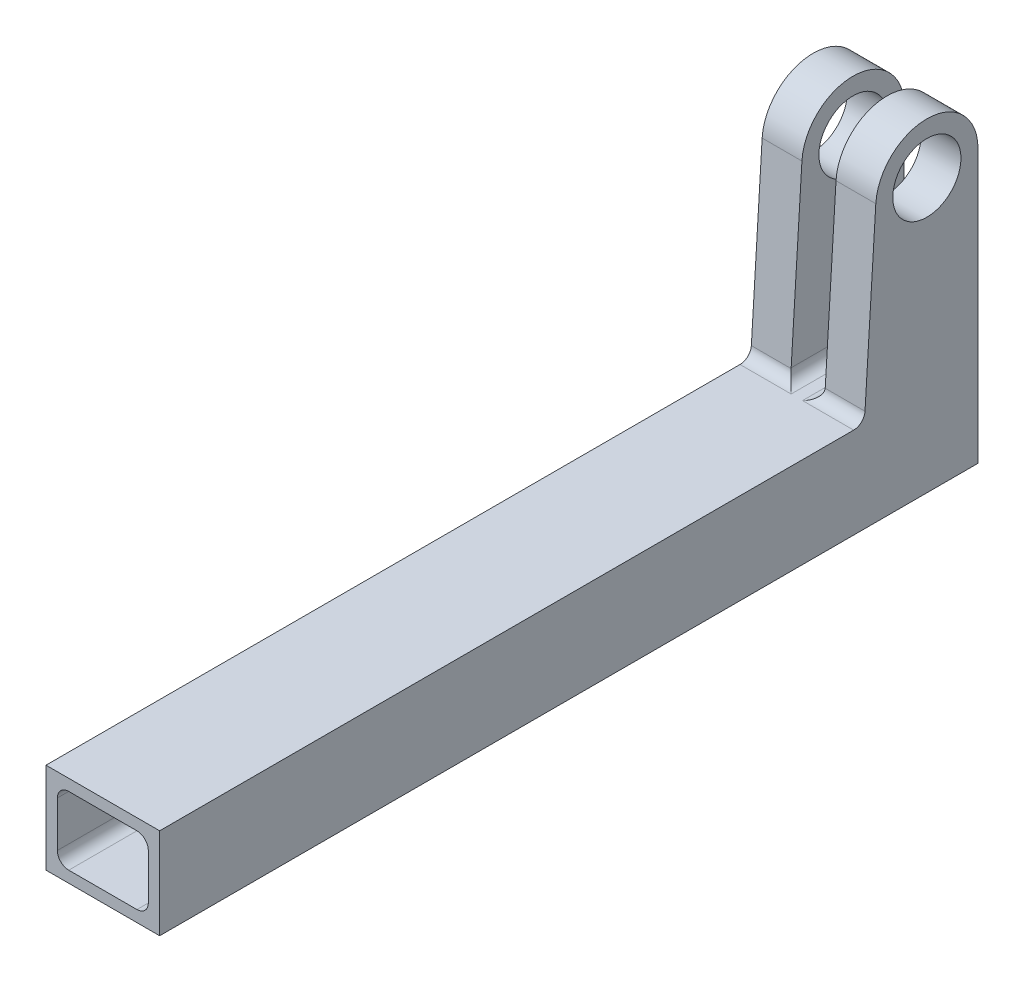
from build123d import *

# Parameters (mm, degrees)
SKETCH2_W           = 127
SKETCH2_H           = 101.6
SKETCH2_W_2         = 101.6
SKETCH2_H_2         = 76.2
BOSS_EXTRUDE2_DEPTH = 914.4
SKETCH1_R           = 38.1
BOSS_EXTRUDE3_DEPTH = 44.45
BOSS_EXTRUDE5_START = -44.45
SKETCH3_R           = 38.1
BOSS_EXTRUDE5_DEPTH = 44.45
FILLET1_R           = 12.7
FILLET2_R           = 12.7


with BuildPart() as part:
    # Sketch2 → Boss-Extrude2 (new body)
    with BuildSketch(Plane.XY):
        with Locations((-63.5, 50.8)):
            Rectangle(SKETCH2_W, SKETCH2_H)
        with Locations((-63.5, 50.8)):
            Rectangle(SKETCH2_W_2, SKETCH2_H_2, mode=Mode.SUBTRACT)
    extrude(amount=BOSS_EXTRUDE2_DEPTH)

    # Sketch1 → Boss-Extrude3 (add)
    with BuildSketch(Plane(origin=(0, 0, 0), x_dir=(0, 0, -1), z_dir=(1, 0, 0))):
        with BuildLine():
            Line((-127, 101.6), (0, 101.6))
            Line((0, 101.6), (0, 304.8))
            ThreePointArc((0, 304.8), (-55.382017361, 361.922646449), (-114.190611982, 308.334272869))
            Line((-114.190611982, 308.334272869), (-127, 101.6))
        make_face()
        with Locations((-57.15, 304.8)):
            Circle(SKETCH1_R, mode=Mode.SUBTRACT)
    extrude(amount=-BOSS_EXTRUDE3_DEPTH)

    # Sketch3 → Boss-Extrude5 (add)
    with BuildSketch(Plane.ZY.offset(127).offset(BOSS_EXTRUDE5_START)):
        with BuildLine():
            Line((0, 304.8), (0, 101.6))
            Line((0, 101.6), (127, 101.6))
            Line((127, 101.6), (114.190611982, 308.334272869))
            ThreePointArc((114.190611982, 308.334272869), (55.382017361, 361.922646449), (0, 304.8))
        make_face()
        with Locations(Location((57.15, 304.8, 0), (0, 0, 180))):
            Circle(SKETCH3_R, mode=Mode.SUBTRACT)
    extrude(amount=BOSS_EXTRUDE5_DEPTH)

    # Fillet1
    fillet1_edges = [part.edges().sort_by_distance(p)[0] for p in [
        (-12.7, 88.9, 457.2),
        (-114.3, 88.9, 457.2),
        (-114.3, 12.7, 457.2),
        (-12.7, 12.7, 457.2),
    ]]
    fillet(fillet1_edges, radius=FILLET1_R)

    # Fillet2
    fillet2_edges = [part.edges().sort_by_distance(p)[0] for p in [
        (-44.45, 101.6, 63.5),
        (-22.225, 101.6, 127),
        (-82.55, 101.6, 63.5),
        (-104.775, 101.6, 127),
    ]]
    fillet(fillet2_edges, radius=FILLET2_R)


solid = part.part
